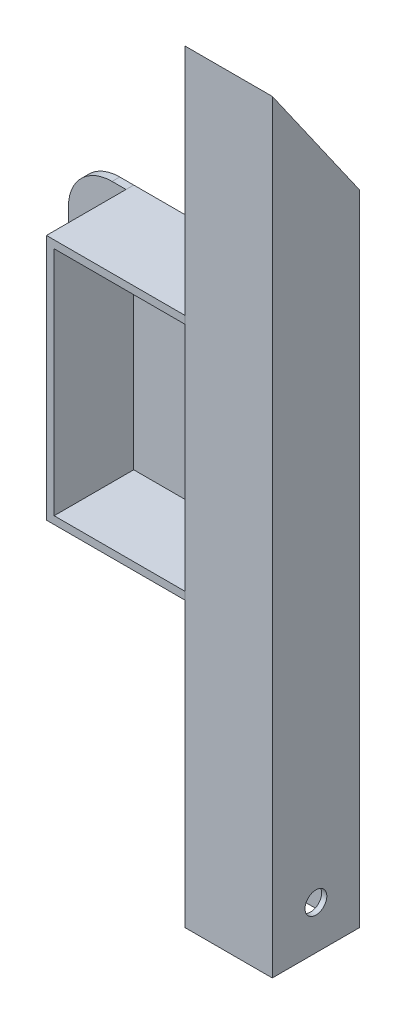
from build123d import *

# Parameters (mm, degrees)
SKETCH2_W               = 25.4
SKETCH2_H               = 25.4
BOSS_EXTRUDE1_DEPTH     = 222.25
CUT_EXTRUDE1_DEPTH      = 226.134143346
CUT_EXTRUDE1_DEPTH_BACK = 226.134143346
SKETCH5_W               = 40.3352
SKETCH5_H               = 71.7804
BOSS_EXTRUDE2_DEPTH     = 25.4
SKETCH6_W               = 38.1
SKETCH6_H               = 67.31
CUT_EXTRUDE2_DEPTH      = 23.1648
SKETCH7_R               = 1.1557
BOSS_EXTRUDE3_DEPTH     = 2.2352
SKETCH8_R               = 3.175
CUT_EXTRUDE3_DEPTH      = 239.424706146
SKETCH9_W               = 22.352
SKETCH9_H               = 22.352
CUT_EXTRUDE5_DEPTH      = 231.869099579


with BuildPart() as part:
    # Sketch2 → Boss-Extrude1 (new body)
    with BuildSketch(Plane(origin=(0, 0, 0), x_dir=(1, 0, 0), z_dir=(0, 1, 0))):
        with Locations((12.7, 12.7)):
            Rectangle(SKETCH2_W, SKETCH2_H)
    extrude(amount=BOSS_EXTRUDE1_DEPTH)

    # Sketch3 → Cut-Extrude1 (cut, two sides: drawn at the far end of the back side and taken through both)
    with BuildSketch(Plane(origin=(25.4, 0, 0), x_dir=(0, 0, -1), z_dir=(1, 0, 0)).offset(-CUT_EXTRUDE1_DEPTH_BACK)):
        Polygon((0, 222.25), (25.4, 222.25), (25.4, 185.975040629), align=None)
    extrude(amount=CUT_EXTRUDE1_DEPTH + CUT_EXTRUDE1_DEPTH_BACK, mode=Mode.SUBTRACT)

    # Sketch8 → Cut-Extrude3 (cut, through all)
    with BuildSketch(Plane(origin=(25.4, 0, 0), x_dir=(0, 0, -1), z_dir=(1, 0, 0))):
        with Locations((12.7, 12.7)):
            Circle(SKETCH8_R)
    extrude(amount=-CUT_EXTRUDE3_DEPTH, mode=Mode.SUBTRACT)

    # Sketch9 → Cut-Extrude5 (cut, through all)
    with BuildSketch(Plane.XZ):
        with Locations((12.7, -12.7)):
            Rectangle(SKETCH9_W, SKETCH9_H)
    extrude(amount=-CUT_EXTRUDE5_DEPTH, mode=Mode.SUBTRACT)


with BuildPart() as body_2:
    # Sketch5 → Boss-Extrude2 (new body)
    with BuildSketch(Plane(origin=(0, 0, -25.4), x_dir=(-1, 0, 0), z_dir=(0, 0, -1))):
        with Locations((20.1676, 118.4402)):
            Rectangle(SKETCH5_W, SKETCH5_H)
    extrude(amount=-BOSS_EXTRUDE2_DEPTH)

    # Sketch6 → Cut-Extrude2 (cut)
    with BuildSketch(Plane.XY):
        with Locations((-19.05, 118.4402)):
            Rectangle(SKETCH6_W, SKETCH6_H)
    extrude(amount=-CUT_EXTRUDE2_DEPTH, mode=Mode.SUBTRACT)


with BuildPart() as body_3:
    # Sketch7 → Boss-Extrude3 (new body)
    with BuildSketch(Plane(origin=(0, 0, -25.4), x_dir=(-1, 0, 0), z_dir=(0, 0, -1))):
        with BuildLine():
            Line((40.3352, 154.3304), (44.3992, 154.3304))
            ThreePointArc((44.3992, 154.3304), (53.379456121, 150.610656121), (57.0992, 141.6304))
            Line((57.0992, 141.6304), (57.0992, 95.25))
            ThreePointArc((57.0992, 95.25), (53.379456121, 86.269743879), (44.3992, 82.55))
            Line((44.3992, 82.55), (40.3352, 82.55))
            Line((40.3352, 82.55), (40.3352, 154.3304))
        make_face()
        with Locations((48.7172, 142.9004)):
            Circle(SKETCH7_R, mode=Mode.SUBTRACT)
        with Locations((48.7172, 130.2004)):
            Circle(SKETCH7_R, mode=Mode.SUBTRACT)
        with Locations((48.7172, 117.5004)):
            Circle(SKETCH7_R, mode=Mode.SUBTRACT)
        with Locations((48.7172, 104.8004)):
            Circle(SKETCH7_R, mode=Mode.SUBTRACT)
        with Locations((48.7172, 92.1004)):
            Circle(SKETCH7_R, mode=Mode.SUBTRACT)
    extrude(amount=-BOSS_EXTRUDE3_DEPTH)


solid = Compound([part.part, body_2.part, body_3.part])
